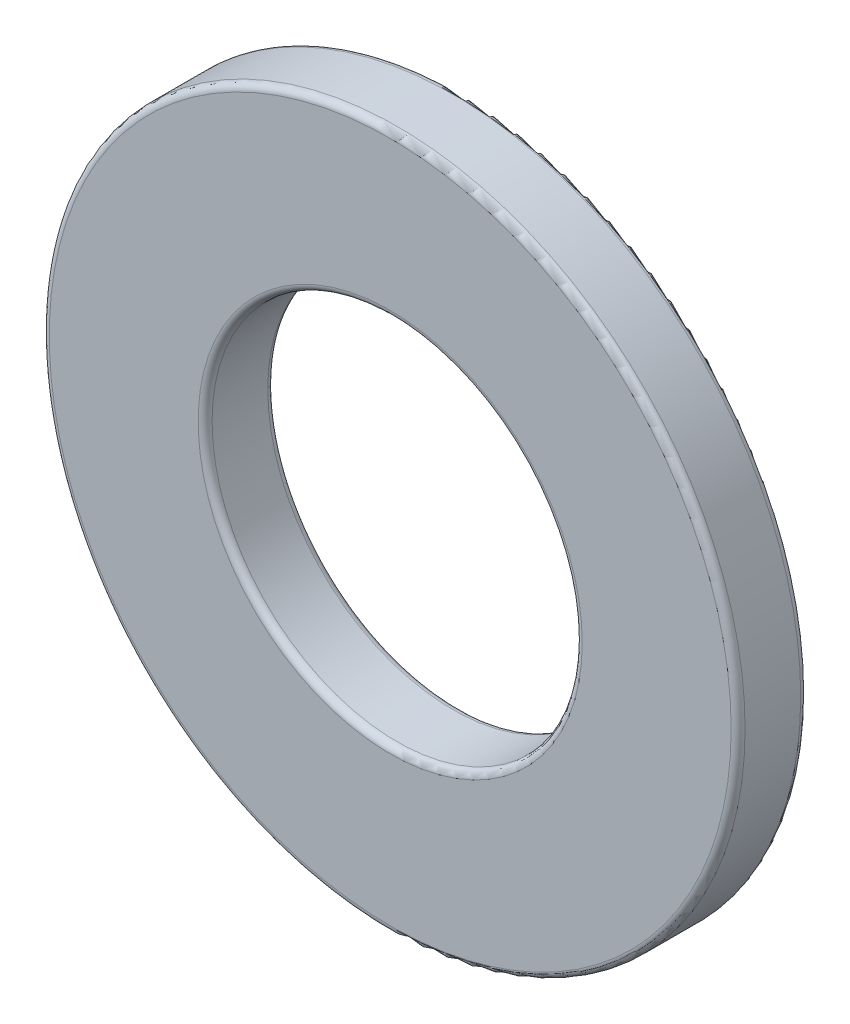
from build123d import *

# Parameters (mm, degrees)
BOSS_EXTRUDE1_START = 0.635
SKETCH3_R           = 6.35
SKETCH3_R_2         = 3.3782
BOSS_EXTRUDE1_DEPTH = 1.27
FILLET1_R           = 0.127


with BuildPart() as part:
    # Sketch3 → Boss-Extrude1 (new body)
    with BuildSketch(Plane.XY.offset(BOSS_EXTRUDE1_START)):
        Circle(SKETCH3_R)
        Circle(SKETCH3_R_2, mode=Mode.SUBTRACT)
    extrude(amount=-BOSS_EXTRUDE1_DEPTH)

    # Fillet1
    fillet1_edges = [part.edges().sort_by_distance(p)[0] for p in [
        (-6.35, 0, 0.635),
        (-6.35, 0, -0.635),
        (-3.3782, 0, -0.635),
        (-3.3782, 0, 0.635),
    ]]
    fillet(fillet1_edges, radius=FILLET1_R)


solid = part.part
